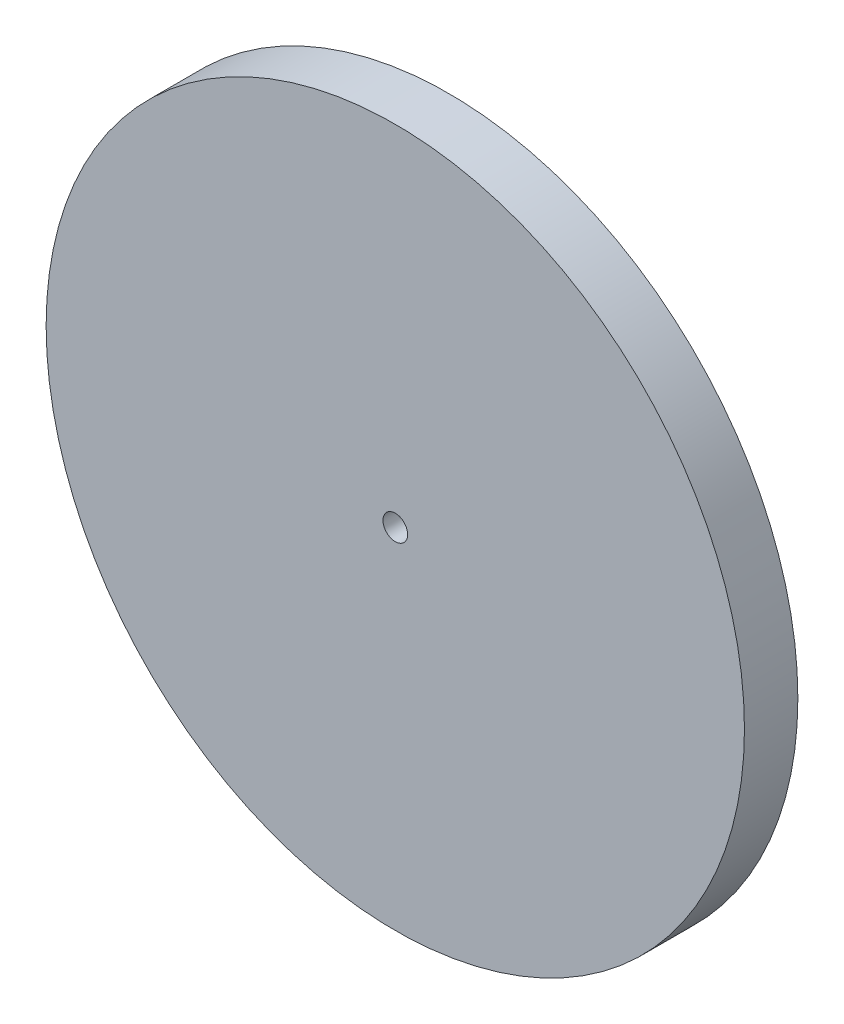
from build123d import *

# Parameters (mm, degrees)
SKIZZE1_R                            = 42.5
AUFSATZ_LINEAR_AUSTRAGEN1_DEPTH      = 6.5
SCHNITT_LINEAR_AUSTRAGEN1_DEPTH      = 61.454528366
SCHNITT_LINEAR_AUSTRAGEN1_DEPTH_BACK = 61.454528366
SKIZZE2_R                            = 1.5


with BuildPart() as part:
    # Skizze1 → Aufsatz-Linear austragen1 (new body)
    with BuildSketch(Plane.XY):
        with Locations(Location((0, 0, 0), (0, 0, 180))):
            Circle(SKIZZE1_R)
    extrude(amount=AUFSATZ_LINEAR_AUSTRAGEN1_DEPTH)

    # Skizze2 → Schnitt-Linear austragen1 (cut, two sides: drawn at the far end of the back side and taken through both)
    with BuildSketch(Plane.XY.offset(6.5).offset(-SCHNITT_LINEAR_AUSTRAGEN1_DEPTH_BACK)):
        Circle(SKIZZE2_R)
    extrude(amount=SCHNITT_LINEAR_AUSTRAGEN1_DEPTH + SCHNITT_LINEAR_AUSTRAGEN1_DEPTH_BACK, mode=Mode.SUBTRACT)


solid = part.part
